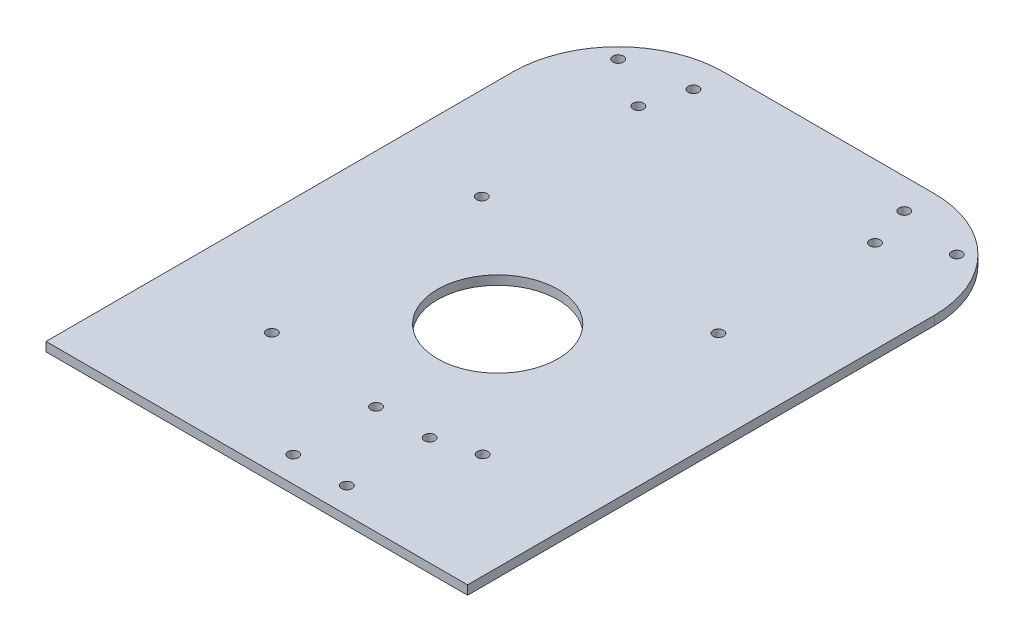
from build123d import *

# Parameters (mm, degrees)
SKETCH_1_W          = 140
SKETCH_1_H          = 220
SKETCH_1_R          = 1.75
EXTRUDE_1_DEPTH     = 3
SKETCH_2_R          = 1.75
SKETCH_2_R_2        = 20
CUT_EXTRUDE_1_DEPTH = 131.418556962
SKETCH_3_R          = 1.75
CUT_EXTRUDE_2_DEPTH = 131.418556962


with BuildPart() as part:
    # 草图1 → 凸台-拉伸1 (new body)
    with BuildSketch(Plane(origin=(0, 0, 0), x_dir=(1, 0, 0), z_dir=(0, 1, 0))):
        Rectangle(SKETCH_1_W, SKETCH_1_H)
        with Locations(Location((21.4, -74, 0), (0, 0, 270))):
            Circle(SKETCH_1_R, mode=Mode.SUBTRACT)
        with Locations(Location((21.4, -101.5, 0), (0, 0, 270))):
            Circle(SKETCH_1_R, mode=Mode.SUBTRACT)
        with Locations(Location((3.6, -101.5, 0), (0, 0, 270))):
            Circle(SKETCH_1_R, mode=Mode.SUBTRACT)
        with Locations(Location((3.6, -74, 0), (0, 0, 270))):
            Circle(SKETCH_1_R, mode=Mode.SUBTRACT)
    extrude(amount=EXTRUDE_1_DEPTH)

    # 草图2 → 切除-拉伸1 (cut, through all)
    with BuildSketch(Plane(origin=(0, 3, 0), x_dir=(1, 0, 0), z_dir=(0, 1, 0))):
        with Locations(Location((-35, 70, 0), (0, 0, 270))):
            Circle(SKETCH_2_R)
        with Locations(Location((35, 70, 0), (0, 0, 270))):
            Circle(SKETCH_2_R)
        with Locations(Location((-35, -70, 0), (0, 0, 270))):
            Circle(SKETCH_2_R)
        with Locations(Location((35, -70, 0), (0, 0, 270))):
            Circle(SKETCH_2_R)
        with Locations(Location((0, -30, 0), (0, 0, 270))):
            Circle(SKETCH_2_R_2)
    extrude(amount=-CUT_EXTRUDE_1_DEPTH, mode=Mode.SUBTRACT)

    # 草图3 → 切除-拉伸2 (cut, through all)
    with BuildSketch(Plane(origin=(0, 3, 0), x_dir=(1, 0, 0), z_dir=(0, 1, 0))):
        with Locations(Location((-39.3, 56, 0), (0, 0, 270))):
            Circle(SKETCH_3_R)
        with Locations(Location((-39.3, 4, 0), (0, 0, 270))):
            Circle(SKETCH_3_R)
        with Locations(Location((39.3, 4, 0), (0, 0, 270))):
            Circle(SKETCH_3_R)
        with Locations(Location((39.3, 56, 0), (0, 0, 270))):
            Circle(SKETCH_3_R)
        with Locations(Location((-56.213203436, 66.213203436, 0), (0, 0, 270))):
            Circle(SKETCH_3_R)
        with Locations(Location((56.213203436, 66.213203436, 0), (0, 0, 90))):
            Circle(SKETCH_3_R)
        with BuildLine():
            Line((-35, 80), (35, 80))
            ThreePointArc((35, 80), (59.748737342, 69.748737342), (70, 45))
            Line((70, 45), (70, 110))
            Line((70, 110), (-70, 110))
            Line((-70, 110), (-70, 45))
            ThreePointArc((-70, 45), (-59.748737342, 69.748737342), (-35, 80))
        make_face()
    extrude(amount=-CUT_EXTRUDE_2_DEPTH, mode=Mode.SUBTRACT)


solid = part.part
